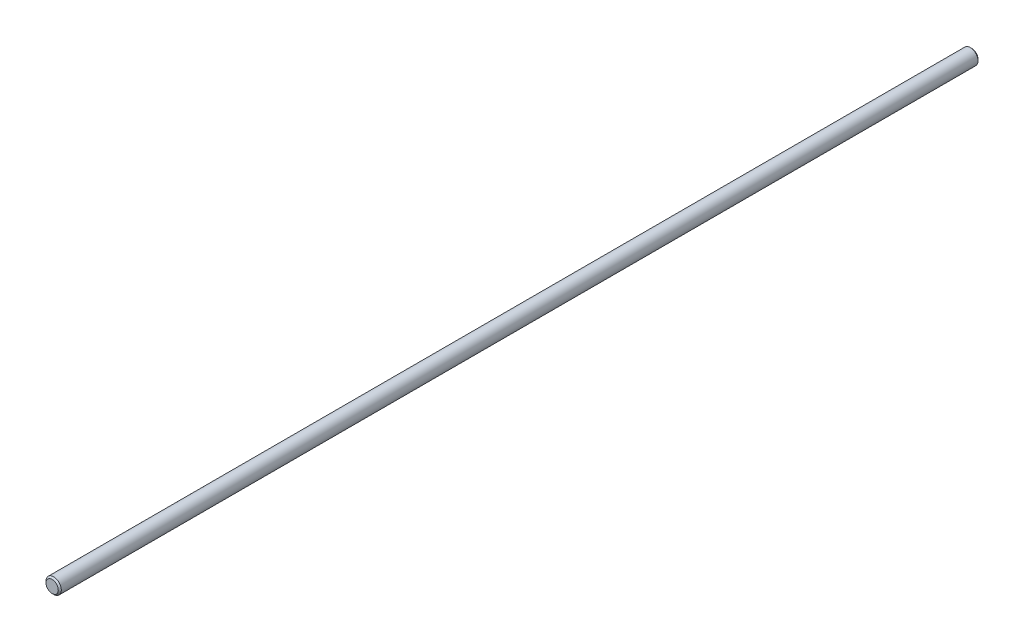
from build123d import *

# Parameters (mm, degrees)
SKETCH1_R           = 12.7
BOSS_EXTRUDE1_DEPTH = 762
CHAMFER1_SIZE       = 2.54


with BuildPart() as part:
    # Sketch1 → Boss-Extrude1 (new, symmetric)
    with BuildSketch(Plane.XY):
        Circle(SKETCH1_R)
    extrude(amount=BOSS_EXTRUDE1_DEPTH, both=True)

    # Chamfer1
    chamfer1_edges = [part.edges().sort_by_distance(p)[0] for p in [
        (-12.7, 0, -762),
        (-12.7, 0, 762),
    ]]
    chamfer(chamfer1_edges, length=CHAMFER1_SIZE)


solid = part.part
